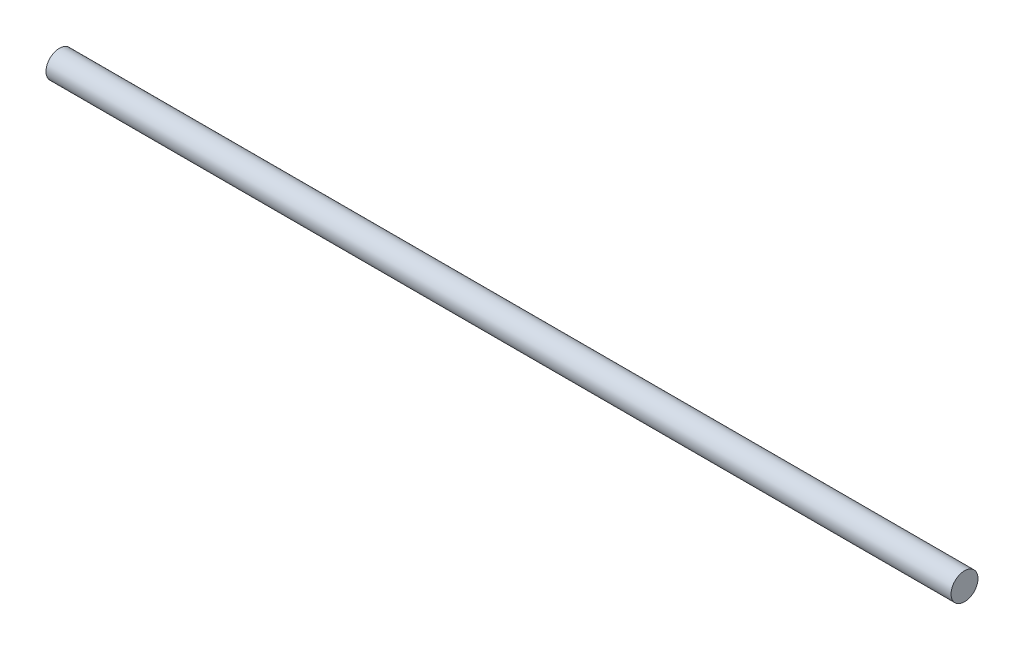
from build123d import *

# Parameters (mm, degrees)
SKETCH1_R           = 3.2
BOSS_EXTRUDE1_DEPTH = 215


with BuildPart() as part:
    # Sketch1 → Boss-Extrude1 (new body)
    with BuildSketch(Plane(origin=(0, 0, 0), x_dir=(0, 0, -1), z_dir=(1, 0, 0))):
        Circle(SKETCH1_R)
    extrude(amount=BOSS_EXTRUDE1_DEPTH)


solid = part.part
